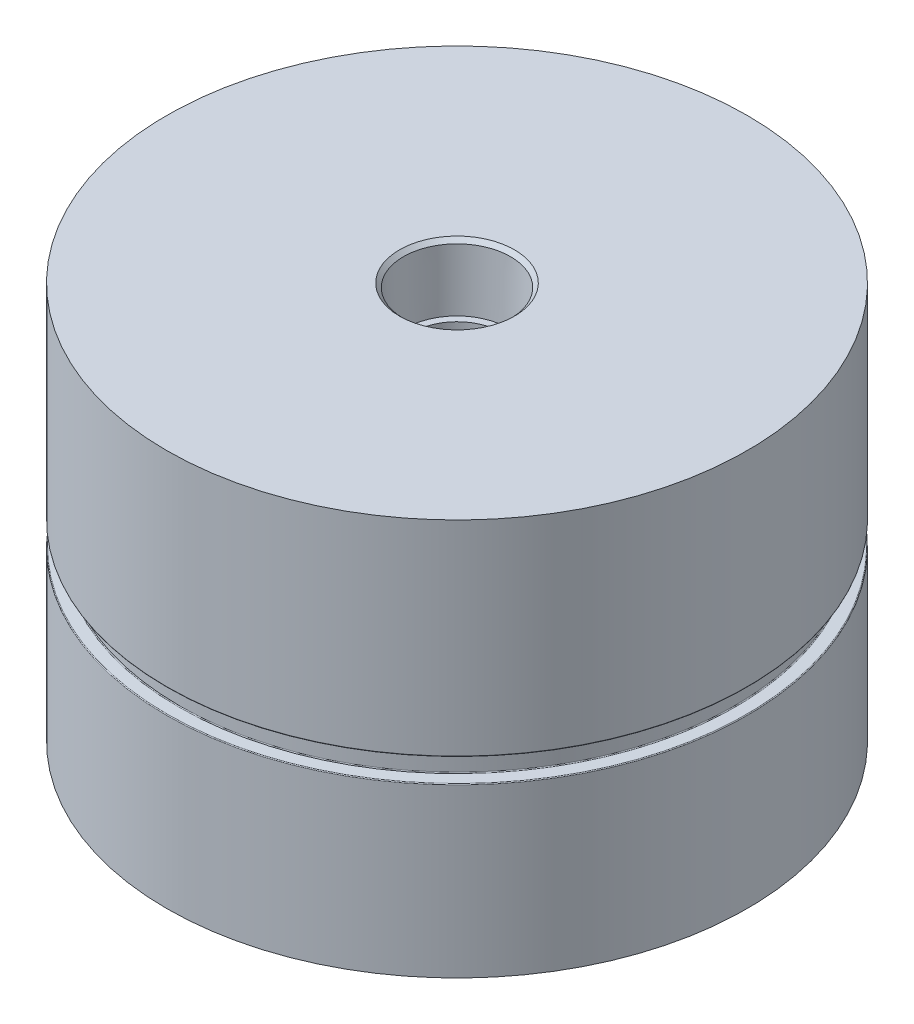
from build123d import *

# Parameters (mm, degrees)
FILLET1_R = 0.127
FILLET2_R = 0.127


with BuildPart() as part:
    # Sketch1 → Revolve3 (revolve)
    with BuildSketch(Plane.XY, mode=Mode.PRIVATE) as revolve3_sk:
        Polygon((0, -33.404421277), (-46.4693, -33.404421277), (-46.4693, -6.520721208), (-44.4373, -6.414228601), (-44.4373, -2.858228601), (-46.4693, -2.751735993), (-46.4693, 30.095578723), (0, 30.095578723), align=None)
    revolve(revolve3_sk.sketch.rotate(Axis((0, 32.189409805, 0), (0, -1, 0)), 270), axis=Axis((0, 32.189409805, 0), (0, -1, 0)))

    # Fillet1
    fillet1_edges = [part.edges().sort_by_distance(p)[0] for p in [
        (0, -2.751735993, -46.4693),
        (0, -6.520721208, -46.4693),
    ]]
    fillet(fillet1_edges, radius=FILLET1_R)

    # Fillet2
    fillet2_edges = [part.edges().sort_by_distance(p)[0] for p in [
        (0, -2.858228601, -44.4373),
        (0, -6.414228601, -44.4373),
    ]]
    fillet(fillet2_edges, radius=FILLET2_R)

    # Sketch10 → 3/8 NPT Tapped Hole2 (revolve, cut)
    with BuildSketch(Plane(origin=(0, 30.095578723, 0), x_dir=(0, 0, 1), z_dir=(1, 0, 0))):
        Polygon((0, 0), (0, 63.5), (7.1374, 63.5), (7.1374, 10.414), (8.269741561, 10.414), (8.5751162, 0.6323838), (9.2075, 0), align=None)
    revolve(axis=Axis((0, 36.445578723, 0), (0, -1, 0)), mode=Mode.SUBTRACT)


solid = part.part
